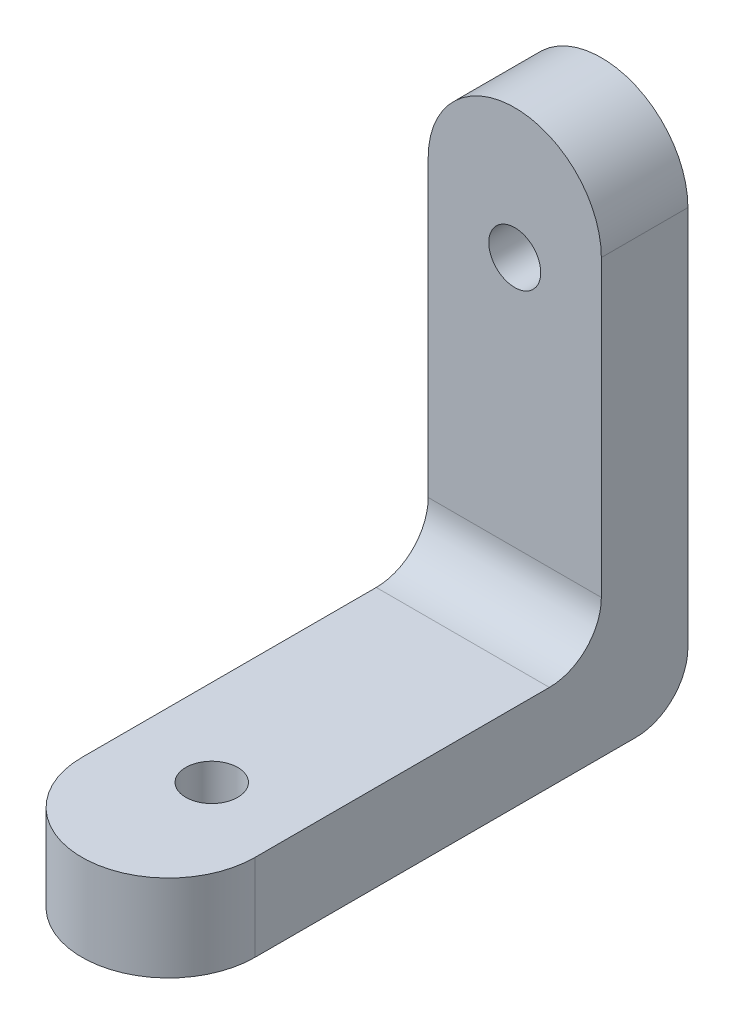
from build123d import *

# Parameters (mm, degrees)
ESQUISSE1_W             = 10
ESQUISSE1_H             = 30
BOSS_EXTRU_1_DEPTH      = 5
ESQUISSE2_W             = 10
ESQUISSE2_H             = 5
BOSS_EXTRU_2_DEPTH      = 25
ESQUISSE3_R             = 1.5
ENL_V_MAT_EXTRU_1_DEPTH = 30
ESQUISSE4_R             = 1.5
ENL_V_MAT_EXTRU_2_DEPTH = 30
CONG_1_RADIUS           = 5
CONG_1_LENGTH           = 5
CONG_2_RADIUS           = 5
CONG_2_LENGTH           = 5
CONG_3_R                = 3
CONG_4_R                = 3


with BuildPart() as part:
    # Esquisse1 → Boss.-Extru.1 (new body)
    with BuildSketch(Plane.XY):
        Rectangle(ESQUISSE1_W, ESQUISSE1_H)
    extrude(amount=BOSS_EXTRU_1_DEPTH)

    # Esquisse2 → Boss.-Extru.2 (add)
    with BuildSketch(Plane.XY.offset(5)):
        with Locations((0, -12.5)):
            Rectangle(ESQUISSE2_W, ESQUISSE2_H)
    extrude(amount=BOSS_EXTRU_2_DEPTH)

    # Esquisse3 → Enlèv. mat.-Extru.1 (cut)
    with BuildSketch(Plane.XY.offset(5)):
        with Locations((0, 7.5)):
            Circle(ESQUISSE3_R)
    extrude(amount=-ENL_V_MAT_EXTRU_1_DEPTH, mode=Mode.SUBTRACT)

    # Esquisse4 → Enlèv. mat.-Extru.2 (cut)
    with BuildSketch(Plane(origin=(0, -10, 0), x_dir=(1, 0, 0), z_dir=(0, 1, 0))):
        with Locations(Location((0, -22.5, 0), (0, 0, 270))):
            Circle(ESQUISSE4_R)
    extrude(amount=-ENL_V_MAT_EXTRU_2_DEPTH, mode=Mode.SUBTRACT)

    # Congé1: full round fillet: the end face becomes a half cylinder, R = half its width
    cong_1_face = Plane((0, 15, 2.5), x_dir=(0, 0, 1), z_dir=(0, 1, 0))  # on the end face: x along it, z out of the body
    cong_1_slab = cong_1_face.offset(-CONG_1_RADIUS / 2) * Box(CONG_1_LENGTH, 2 * CONG_1_RADIUS, CONG_1_RADIUS, mode=Mode.PRIVATE)  # the body's end, R deep
    cong_1_round = Plane((0, 10, 2.5), x_dir=(0, 1, 0), z_dir=(0, 0, 1)) * Cylinder(CONG_1_RADIUS, CONG_1_LENGTH, mode=Mode.PRIVATE)  # its axis R under the face
    add(cong_1_slab - cong_1_round, mode=Mode.SUBTRACT)

    # Congé2: full round fillet: the end face becomes a half cylinder, R = half its width
    cong_2_face = Plane((0, -12.5, 30), x_dir=(0, 1, 0), z_dir=(0, 0, 1))  # on the end face: x along it, z out of the body
    cong_2_slab = cong_2_face.offset(-CONG_2_RADIUS / 2) * Box(CONG_2_LENGTH, 2 * CONG_2_RADIUS, CONG_2_RADIUS, mode=Mode.PRIVATE)  # the body's end, R deep
    cong_2_round = Plane((0, -12.5, 25), x_dir=(0, 0, 1), z_dir=(0, 1, 0)) * Cylinder(CONG_2_RADIUS, CONG_2_LENGTH, mode=Mode.PRIVATE)  # its axis R under the face
    add(cong_2_slab - cong_2_round, mode=Mode.SUBTRACT)

    # Congé3
    cong_3_edges = [part.edges().sort_by_distance(p)[0] for p in [
        (0, -15, 0),
    ]]
    fillet(cong_3_edges, radius=CONG_3_R)

    # Congé4
    cong_4_edges = [part.edges().sort_by_distance(p)[0] for p in [
        (0, -10, 5),
    ]]
    fillet(cong_4_edges, radius=CONG_4_R)


solid = part.part
